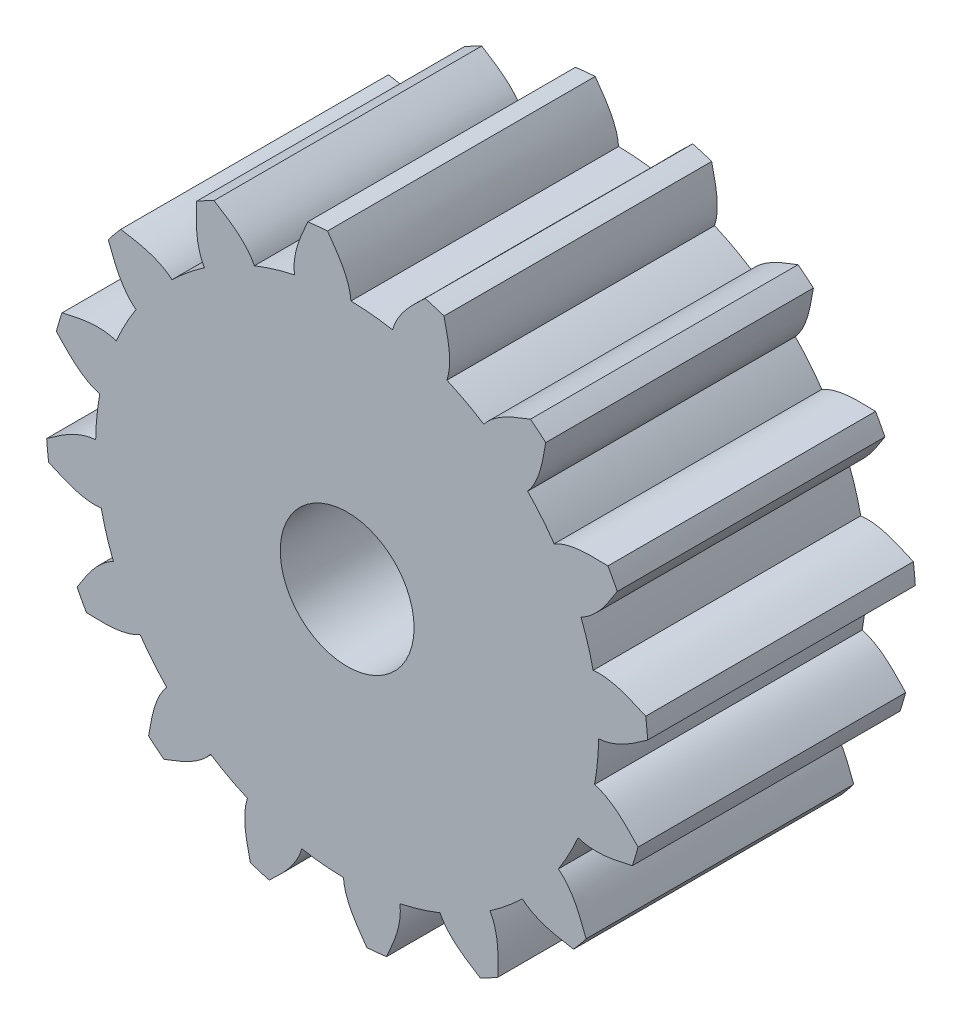
from build123d import *

# Parameters (mm, degrees)
BOSS_EXTRUDE7_DEPTH = 2
CIRPATTERN1_COUNT   = 16
DIAMETRO_BASE_R     = 1.879385242
BOSS_EXTRUDE9_DEPTH = 2
MOZZO_R             = 0.5
CUT_EXTRUDE1_DEPTH  = 2


with BuildPart() as part:
    # profilo → Boss-Extrude7 (new body)
    with BuildSketch(Plane.XY):
        with BuildLine():
            Line((-0.220538566, 2.239165635), (-0.184211967, 1.870335488))
            ThreePointArc((-0.184211967, 1.870335488), (-0.078225963, 1.87775653), (0.028010042, 1.879176501))
            add(Edge.make_bspline(
                [(-0.14670524, 2.245212144), (-0.068888242, 2.136288179), (0.01902302, 2.014536344), (0.028010042, 1.879176501)],
                knots=[0.201514188, 0.201514188, 0.201514188, 0.201514188, 1, 1, 1, 1], degree=3))
            ThreePointArc((-0.14670524, 2.245212144), (-0.18364679, 2.242492777), (-0.220538566, 2.239165635))
        make_face()
    extrude(amount=BOSS_EXTRUDE7_DEPTH)

    # Mirror1: part across plane


with BuildPart() as part_1:
    add(part.part)
    add(part.part.mirror(Plane(origin=(0, 0, 0), x_dir=(0, 0, 1), z_dir=(0.9951847266721969, 0.09801714032956144, 0))))


with BuildPart() as cirpattern1_1:
    # CirPattern1: pattern copy
    add(part_1.part.rotate(Axis((0, 0, 2), (0, 0, 1)), 1 * 360 / CIRPATTERN1_COUNT))


with BuildPart() as cirpattern1_2:
    # CirPattern1: pattern copy
    add(part_1.part.rotate(Axis((0, 0, 2), (0, 0, 1)), 2 * 360 / CIRPATTERN1_COUNT))


with BuildPart() as cirpattern1_3:
    # CirPattern1: pattern copy
    add(part_1.part.rotate(Axis((0, 0, 2), (0, 0, 1)), 3 * 360 / CIRPATTERN1_COUNT))


with BuildPart() as cirpattern1_4:
    # CirPattern1: pattern copy
    add(part_1.part.rotate(Axis((0, 0, 2), (0, 0, 1)), 4 * 360 / CIRPATTERN1_COUNT))


with BuildPart() as cirpattern1_5:
    # CirPattern1: pattern copy
    add(part_1.part.rotate(Axis((0, 0, 2), (0, 0, 1)), 5 * 360 / CIRPATTERN1_COUNT))


with BuildPart() as cirpattern1_6:
    # CirPattern1: pattern copy
    add(part_1.part.rotate(Axis((0, 0, 2), (0, 0, 1)), 6 * 360 / CIRPATTERN1_COUNT))


with BuildPart() as cirpattern1_7:
    # CirPattern1: pattern copy
    add(part_1.part.rotate(Axis((0, 0, 2), (0, 0, 1)), 7 * 360 / CIRPATTERN1_COUNT))


with BuildPart() as cirpattern1_8:
    # CirPattern1: pattern copy
    add(part_1.part.rotate(Axis((0, 0, 2), (0, 0, 1)), 8 * 360 / CIRPATTERN1_COUNT))


with BuildPart() as cirpattern1_9:
    # CirPattern1: pattern copy
    add(part_1.part.rotate(Axis((0, 0, 2), (0, 0, 1)), 9 * 360 / CIRPATTERN1_COUNT))


with BuildPart() as cirpattern1_10:
    # CirPattern1: pattern copy
    add(part_1.part.rotate(Axis((0, 0, 2), (0, 0, 1)), 10 * 360 / CIRPATTERN1_COUNT))


with BuildPart() as cirpattern1_11:
    # CirPattern1: pattern copy
    add(part_1.part.rotate(Axis((0, 0, 2), (0, 0, 1)), 11 * 360 / CIRPATTERN1_COUNT))


with BuildPart() as cirpattern1_12:
    # CirPattern1: pattern copy
    add(part_1.part.rotate(Axis((0, 0, 2), (0, 0, 1)), 12 * 360 / CIRPATTERN1_COUNT))


with BuildPart() as cirpattern1_13:
    # CirPattern1: pattern copy
    add(part_1.part.rotate(Axis((0, 0, 2), (0, 0, 1)), 13 * 360 / CIRPATTERN1_COUNT))


with BuildPart() as cirpattern1_14:
    # CirPattern1: pattern copy
    add(part_1.part.rotate(Axis((0, 0, 2), (0, 0, 1)), 14 * 360 / CIRPATTERN1_COUNT))


with BuildPart() as cirpattern1_15:
    # CirPattern1: pattern copy
    add(part_1.part.rotate(Axis((0, 0, 2), (0, 0, 1)), 15 * 360 / CIRPATTERN1_COUNT))


with BuildPart() as part_2:
    add(part_1.part)

    add(cirpattern1_1.part)  # Boss-Extrude9 merges CirPattern1_1

    add(cirpattern1_2.part)  # Boss-Extrude9 merges CirPattern1_2

    add(cirpattern1_3.part)  # Boss-Extrude9 merges CirPattern1_3

    add(cirpattern1_4.part)  # Boss-Extrude9 merges CirPattern1_4

    add(cirpattern1_5.part)  # Boss-Extrude9 merges CirPattern1_5

    add(cirpattern1_6.part)  # Boss-Extrude9 merges CirPattern1_6

    add(cirpattern1_7.part)  # Boss-Extrude9 merges CirPattern1_7

    add(cirpattern1_8.part)  # Boss-Extrude9 merges CirPattern1_8

    add(cirpattern1_9.part)  # Boss-Extrude9 merges CirPattern1_9

    add(cirpattern1_10.part)  # Boss-Extrude9 merges CirPattern1_10

    add(cirpattern1_11.part)  # Boss-Extrude9 merges CirPattern1_11

    add(cirpattern1_12.part)  # Boss-Extrude9 merges CirPattern1_12

    add(cirpattern1_13.part)  # Boss-Extrude9 merges CirPattern1_13

    add(cirpattern1_14.part)  # Boss-Extrude9 merges CirPattern1_14

    add(cirpattern1_15.part)  # Boss-Extrude9 merges CirPattern1_15
    # diametro base → Boss-Extrude9 (add)
    with BuildSketch(Plane.XY):
        Circle(DIAMETRO_BASE_R)
    extrude(amount=BOSS_EXTRUDE9_DEPTH)

    # mozzo → Cut-Extrude1 (cut)
    with BuildSketch(Plane.XY):
        Circle(MOZZO_R)
    extrude(amount=CUT_EXTRUDE1_DEPTH, mode=Mode.SUBTRACT)


solid = part_2.part
